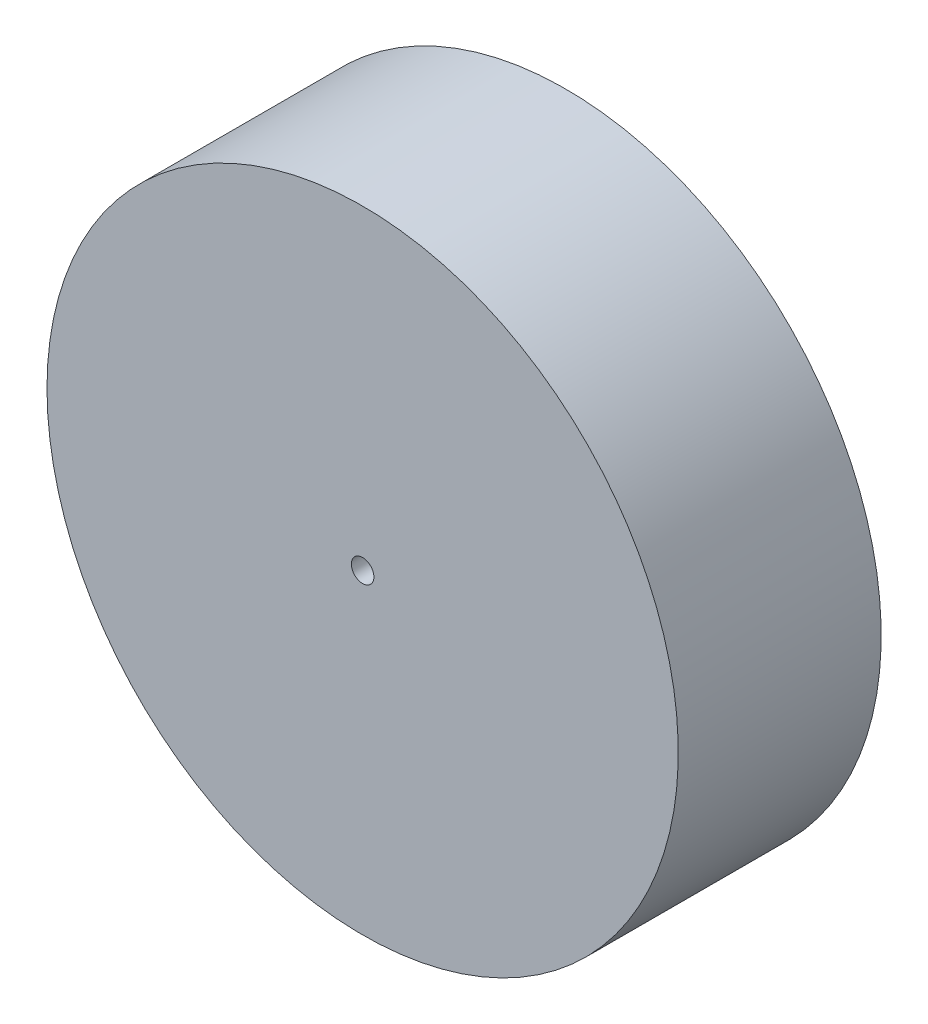
from build123d import *

# Parameters (mm, degrees)
SKETCH1_R           = 70
BOSS_EXTRUDE1_DEPTH = 45
SKETCH2_R           = 2.5
CUT_EXTRUDE1_DEPTH  = 20


with BuildPart() as part:
    # Sketch1 → Boss-Extrude1 (new body)
    with BuildSketch(Plane.XY):
        with Locations(Location((0, 0, 0), (0, 0, 180))):
            Circle(SKETCH1_R)
    extrude(amount=BOSS_EXTRUDE1_DEPTH)

    # Sketch2 → Cut-Extrude1 (cut)
    with BuildSketch(Plane.XY.offset(45)):
        Circle(SKETCH2_R)
    extrude(amount=-CUT_EXTRUDE1_DEPTH, mode=Mode.SUBTRACT)


solid = part.part
